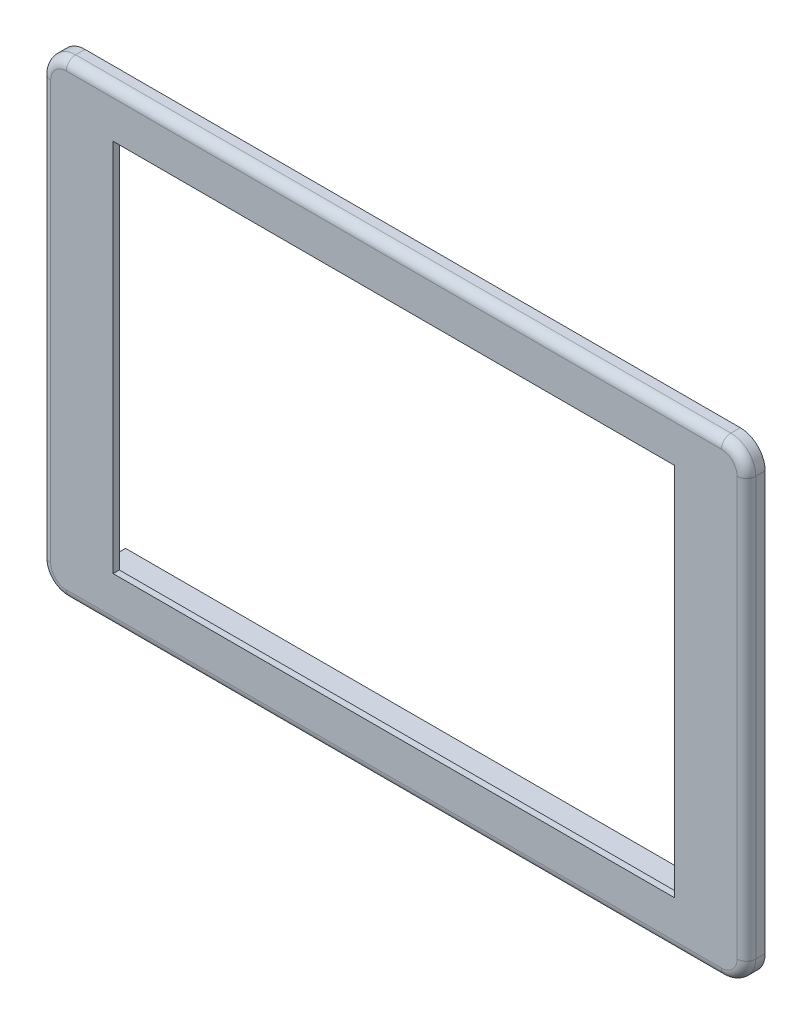
from build123d import *

# Parameters (mm, degrees)
SKETCH1_W               = 113
SKETCH1_H               = 75
SKETCH1_W_2             = 98
SKETCH1_H_2             = 63
BOSS_EXTRUDE1_DEPTH     = 3
FILLET1_R               = 4
SKETCH2_W               = 98
SKETCH2_H               = 2.5
BOSS_EXTRUDE2_DEPTH     = 3
FILLET2_R               = 1.5
SKETCH3_W               = 98
SKETCH3_H               = 63
SKETCH3_W_2             = 90
SKETCH3_H_2             = 60
BOSS_EXTRUDE3_DEPTH     = 1
CUT_EXTRUDE1_DEPTH      = 114.169815067
CUT_EXTRUDE1_DEPTH_BACK = 114.169815067


with BuildPart() as part:
    # Sketch1 → Boss-Extrude1 (new body)
    with BuildSketch(Plane.XY):
        with Locations((-26.020950744, 3.343078266)):
            Rectangle(SKETCH1_W, SKETCH1_H)
        with Locations((-26.020950744, 3.343078266)):
            Rectangle(SKETCH1_W_2, SKETCH1_H_2, mode=Mode.SUBTRACT)
    extrude(amount=BOSS_EXTRUDE1_DEPTH)

    # Fillet1
    fillet1_edges = [part.edges().sort_by_distance(p)[0] for p in [
        (-82.520950744, 40.843078266, 1.5),
        (30.479049256, 40.843078266, 1.5),
        (30.479049256, -34.156921734, 1.5),
        (-82.520950744, -34.156921734, 1.5),
    ]]
    fillet(fillet1_edges, radius=FILLET1_R)

    # Sketch2 → Boss-Extrude2 (add)
    with BuildSketch(Plane(origin=(0, 0, 0), x_dir=(-1, 0, 0), z_dir=(0, 0, -1))):
        with Locations((26.020950744, 36.093078266)):
            Rectangle(SKETCH2_W, SKETCH2_H)
        with Locations((26.020950744, -29.406921734)):
            Rectangle(SKETCH2_W, SKETCH2_H)
    extrude(amount=BOSS_EXTRUDE2_DEPTH)

    # Fillet2
    fillet2_edges = [part.edges().sort_by_distance(p)[0] for p in [
        (-82.520950744, 3.343078266, 3),
        (-26.020950744, 40.843078266, 3),
        (-26.020950744, -34.156921734, 3),
        (30.479049256, 3.343078266, 3),
        (29.307476381, 39.67150539, 3),
        (29.307476381, -32.985348859, 3),
        (-81.349377868, -32.985348859, 3),
        (-81.349377868, 39.67150539, 3),
    ]]
    fillet(fillet2_edges, radius=FILLET2_R)

    # Sketch3 → Boss-Extrude3 (add)
    with BuildSketch(Plane.XY.offset(3)):
        with Locations((-26.020950744, 3.343078266)):
            Rectangle(SKETCH3_W, SKETCH3_H)
        with Locations((-26.020950744, 3.343078266)):
            Rectangle(SKETCH3_W_2, SKETCH3_H_2, mode=Mode.SUBTRACT)
    extrude(amount=-BOSS_EXTRUDE3_DEPTH)

    # Sketch4 → Cut-Extrude1 (cut, two sides: drawn at the far end of the back side and taken through both)
    with BuildSketch(Plane.ZY.offset(75.020950744).offset(-CUT_EXTRUDE1_DEPTH_BACK)):
        Polygon((0, 37.343078266), (-2.5, 34.843078266), (-3, 34.843078266), (-3, 37.343078266), align=None)
    extrude(amount=CUT_EXTRUDE1_DEPTH + CUT_EXTRUDE1_DEPTH_BACK, mode=Mode.SUBTRACT)


solid = part.part
